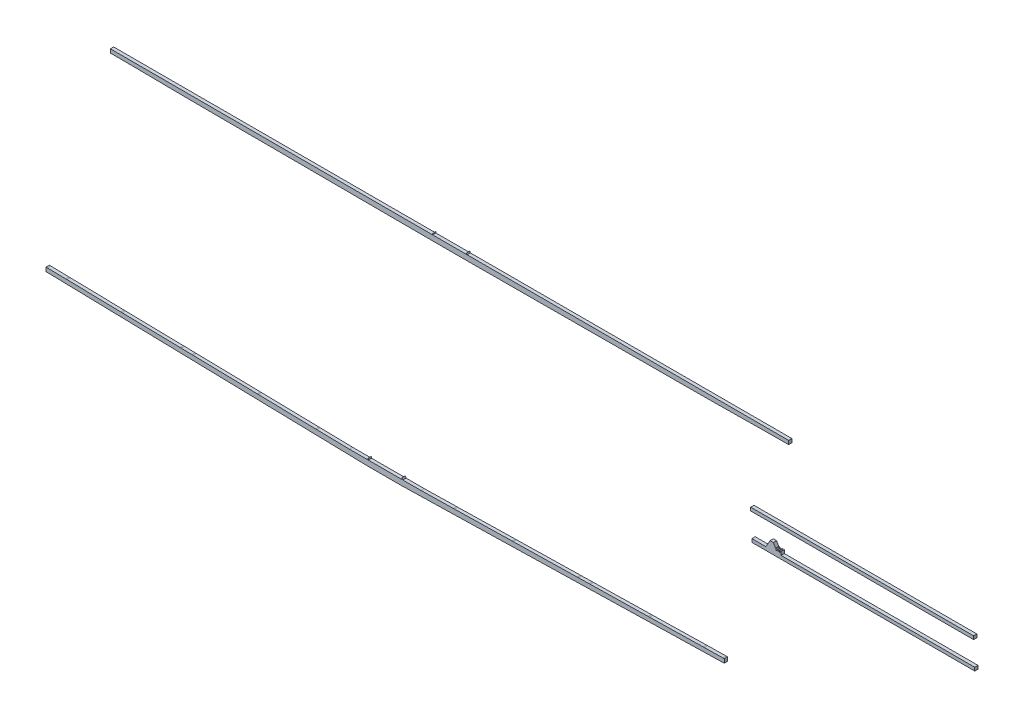
from build123d import *

# Parameters (mm, degrees)
MODEL_W           = 342.366650955
MODEL_H           = 5.1
EXTRUDE_1_DEPTH   = 5
EXTRUDE_1_2_DEPTH = 5
EXTRUDE_1_3_DEPTH = 5
EXTRUDE_1_4_DEPTH = 5


with BuildPart() as part:
    # Model → 凸台-拉伸1 (new body)
    with BuildSketch(Plane.XY):
        with Locations((750.686747378, 59.554962924)):
            Rectangle(MODEL_W, MODEL_H)
    extrude(amount=EXTRUDE_1_DEPTH)


with BuildPart() as body_2:
    # Model → Extrude 1 2 (new body)
    with BuildSketch(Plane.XY):
        Polygon((614.246138188, 32.484405329), (617.67653772, 26.54277905), (618.559903109, 26.54277905), (618.559903109, 23.568043607), (621.143191819, 26.54277905), (621.143191819, 23.568043607), (623.726480529, 26.54277905), (623.726480529, 23.568043607), (626.111252729, 26.54277905), (626.111252729, 21.209813756), (923.648003194, 21.209813756), (923.648003194, 16.109813756), (581.281303194, 16.109813756), (581.281303194, 21.209813756), (602.736749709, 21.209813756), (609.246138188, 32.484405329), align=None)
    extrude(amount=EXTRUDE_1_2_DEPTH)


with BuildPart() as body_3:
    # Model → Extrude 1 3 (new body)
    with BuildSketch(Plane.XY):
        Polygon((143.754855357, 180.061566324), (637.766892066, 180.061566324), (637.766892066, 174.389466324), (635.766892066, 174.389466324), (607.417562069, 174.266766324), (605.417562069, 174.266766324), (522.753244134, 173.328437251), (520.753244134, 173.319766324), (431.767168163, 172.933970442), (429.767168163, 172.933966324), (413.767168163, 172.942566324), (411.767168163, 172.942566324), (313.517246909, 172.572666324), (311.517246909, 172.572666324), (223.517246909, 172.262766324), (221.517246909, 172.262766324), (142.758356713, 171.99776752), (116.762748322, 171.99776752), (90.767139931, 171.99776752), (12.008249736, 172.262766324), (10.008249736, 172.262766324), (-77.991750264, 172.572666324), (-79.991750264, 172.572666324), (-178.241671518, 172.942566324), (-180.241671518, 172.942566324), (-196.241671518, 172.933966324), (-198.241671518, 172.933970442), (-287.227747489, 173.319766324), (-289.227747489, 173.328437251), (-371.892065424, 174.266766324), (-373.892065424, 174.266766324), (-402.241395422, 174.389466324), (-404.241395422, 174.389466324), (-404.241395422, 180.061566324), (89.770641288, 180.061566324), (90.762748322, 181.881511431), (90.762748322, 180.061566324), (116.762748322, 180.061566324), (142.762748322, 180.061566324), (142.762748322, 181.881511431), align=None)
    extrude(amount=EXTRUDE_1_3_DEPTH)


with BuildPart() as body_4:
    # Model → Extrude 1 4 (new body)
    with BuildSketch(Plane.XY):
        with BuildLine():
            Line((43.845523177, -177.492582663), (538.81027344, -165.856176204))
            Line((538.81027344, -165.856176204), (538.81027344, -159.776195336))
            Line((538.81027344, -159.776195336), (536.81027344, -159.776195336))
            Line((536.81027344, -159.776195336), (508.460943442, -160.297194912))
            Line((508.460943442, -160.297194912), (506.460943442, -160.297194912))
            Line((506.460943442, -160.297194912), (423.796625507, -162.048616282))
            Line((423.796625507, -162.048616282), (421.796625507, -162.048616282))
            Line((421.796625507, -162.048616282), (332.810549536, -163.795959439))
            Line((332.810549536, -163.795959439), (330.810549536, -163.795959439))
            Line((330.810549536, -163.795959439), (314.810549536, -164.194907743))
            Line((314.810549536, -164.194907743), (312.810549536, -164.194907743))
            Line((312.810549536, -164.194907743), (214.560628282, -166.204763766))
            Line((214.560628282, -166.204763766), (212.591381202, -166.204763766))
            ThreePointArc((212.591381202, -166.204763766), (212.560629898, -166.204921378), (212.529881824, -166.205394195))
            Line((212.529881824, -166.205394195), (124.560628282, -168.009124705))
            Line((124.560628282, -168.009124705), (122.560628282, -168.009124705))
            Line((122.560628282, -168.009124705), (72.913804388, -168.993411369))
            Line((72.913804388, -168.993411369), (45.043435184, -168.993411369))
            Line((45.043435184, -168.993411369), (43.780250092, -166.49051255))
            Line((43.780250092, -166.49051255), (43.775013962, -168.993411369))
            Line((43.775013962, -168.993411369), (17.81027344, -168.993411369))
            Line((17.81027344, -168.993411369), (-8.154467083, -168.993411369))
            Line((-8.154467083, -168.993411369), (-8.159703213, -166.49051255))
            Line((-8.159703213, -166.49051255), (-9.422888304, -168.993411369))
            Line((-9.422888304, -168.993411369), (-37.293257509, -168.993411369))
            Line((-37.293257509, -168.993411369), (-86.940081403, -168.009124705))
            Line((-86.940081403, -168.009124705), (-88.940081403, -168.009124705))
            Line((-88.940081403, -168.009124705), (-176.909334945, -166.205394195))
            ThreePointArc((-176.909334945, -166.205394195), (-176.940083018, -166.204921378), (-176.970834323, -166.204763766))
            Line((-176.970834323, -166.204763766), (-178.940081403, -166.204763766))
            Line((-178.940081403, -166.204763766), (-277.190002657, -164.194907743))
            Line((-277.190002657, -164.194907743), (-279.190002657, -164.194907743))
            Line((-279.190002657, -164.194907743), (-295.190002657, -163.795959439))
            Line((-295.190002657, -163.795959439), (-297.190002657, -163.795959439))
            Line((-297.190002657, -163.795959439), (-386.176078628, -162.048616282))
            Line((-386.176078628, -162.048616282), (-388.176078628, -162.048616282))
            Line((-388.176078628, -162.048616282), (-470.840396563, -160.297194912))
            Line((-470.840396563, -160.297194912), (-472.840396563, -160.297194912))
            Line((-472.840396563, -160.297194912), (-501.18972656, -159.776195336))
            Line((-501.18972656, -159.776195336), (-503.18972656, -159.776195336))
            Line((-503.18972656, -159.776195336), (-503.18972656, -165.856176204))
            Line((-503.18972656, -165.856176204), (-8.224976298, -177.492582663))
            ThreePointArc((-8.224976298, -177.492582663), (-8.189724125, -177.493204186), (-8.154467083, -177.493411369))
            Line((-8.154467083, -177.493411369), (17.81027344, -177.493411369))
            Line((17.81027344, -177.493411369), (43.775013962, -177.493411369))
            ThreePointArc((43.775013962, -177.493411369), (43.810271005, -177.493204186), (43.845523177, -177.492582663))
        make_face()
    extrude(amount=EXTRUDE_1_4_DEPTH)


solid = Compound([part.part, body_2.part, body_3.part, body_4.part])
